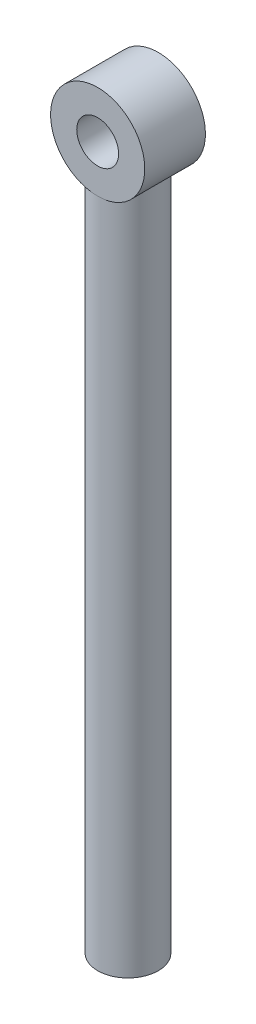
from build123d import *
from build123d.topology import SkipClean

# Parameters (mm, degrees)
SKETCH_1_R             = 5.795
EXTRUDE_1_DEPTH        = 132.19
EXTRUDE_1_2_DEPTH      = 6.19
EXTRUDE_1_2_DEPTH_BACK = 6
SKETCH_3_R             = 9
SKETCH_3_R_2           = 4
CUT_EXTRUDE_1_DEPTH    = 169.19
CUT_EXTRUDE_2_DEPTH    = 147.589618092


with BuildPart() as part:
    # 草圖1 → Extrude 1 (new body)
    with BuildSketch(Plane(origin=(0, 0, 0), x_dir=(1, 0, 0), z_dir=(0, 1, 0))):
        with Locations(Location((0, 0, 0), (0, 0, 270))):
            Circle(SKETCH_1_R)
    extrude(amount=EXTRUDE_1_DEPTH)

    # 草圖3 → Extrude 1 2 (add, two sides: drawn at the far end of the back side and taken through both)
    with BuildSketch(Plane.XY.offset(-EXTRUDE_1_2_DEPTH_BACK)):
        with Locations((0, 137.19)):
            Circle(SKETCH_3_R)
        with Locations((0, 137.19)):
            Circle(SKETCH_3_R_2, mode=Mode.SUBTRACT)
    extrude(amount=EXTRUDE_1_2_DEPTH + EXTRUDE_1_2_DEPTH_BACK)

    # 草圖7 → 除料-伸長1 (cut)
    with BuildSketch(Plane.XZ):
        Polygon((0, 5.795), (-10.217691175, 5.795), (-10.217691175, 6.299881628), (9.331279514, 6.299881628), (9.331279514, 5.795), align=None)
    extrude(amount=-CUT_EXTRUDE_1_DEPTH, mode=Mode.SUBTRACT)

    # 草圖8 → 除料-伸長2 (cut, through all)
    with SkipClean():  # the faces are left unmerged after this step: merging them gives an invalid solid
        with BuildSketch(Plane.XZ):
            Polygon((0, -5.795), (-9.78646388, -5.795), (-9.78646388, -6.666737707), (9.307322442, -6.666737707), (9.307322442, -5.795), align=None)
        extrude(amount=-CUT_EXTRUDE_2_DEPTH, mode=Mode.SUBTRACT)


solid = part.part
